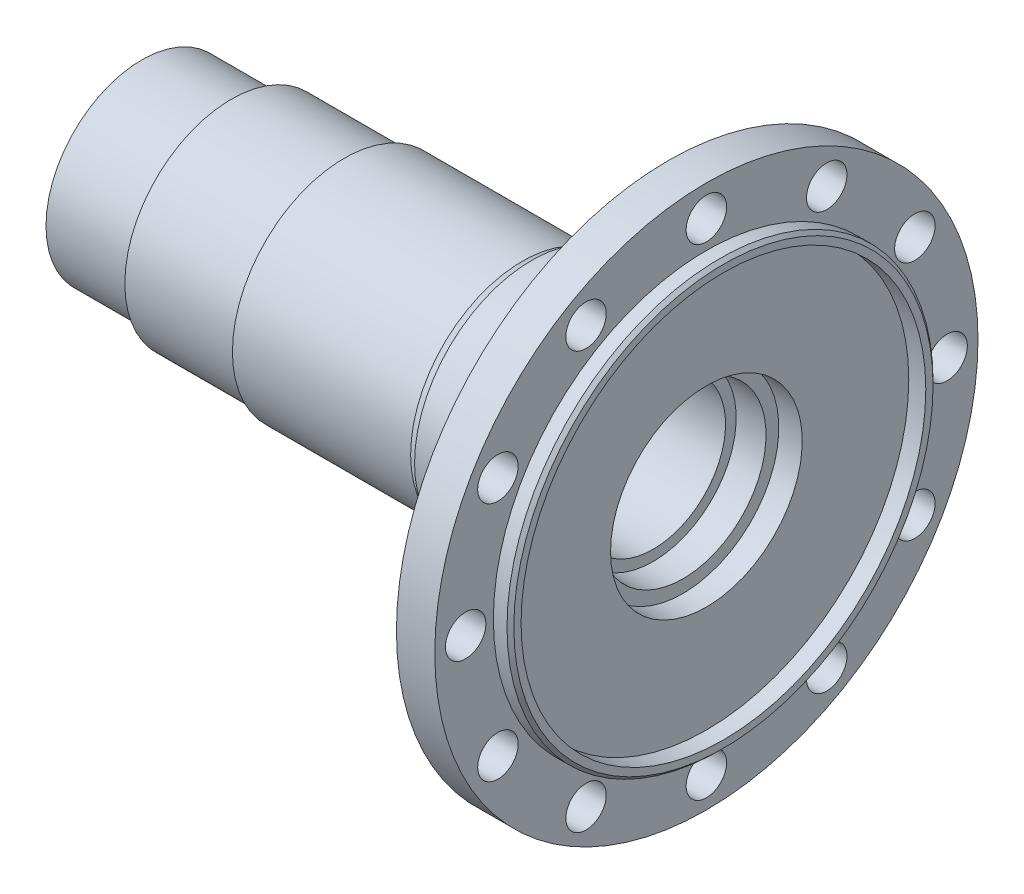
from build123d import *

# Parameters (mm, degrees)
SKETCH_3_R           = 9.5
CUT_EXTRUDE_1_DEPTH  = 328.171973127
SKETCH_4_R           = 9.5
CUT_EXTRUDE_2_DEPTH  = 328.171973127
SKETCH_5_R           = 9.5
CUT_EXTRUDE_3_DEPTH  = 328.171973127
SKETCH_6_R           = 9.5
CUT_EXTRUDE_4_DEPTH  = 328.171973127
SKETCH_7_R           = 9.5
CUT_EXTRUDE_5_DEPTH  = 328.171973127
SKETCH_8_R           = 9.5
CUT_EXTRUDE_6_DEPTH  = 328.171973127
SKETCH_9_R           = 9.5
CUT_EXTRUDE_7_DEPTH  = 328.171973127
SKETCH_10_R          = 9.5
CUT_EXTRUDE_8_DEPTH  = 328.171973127
SKETCH_11_R          = 9.5
CUT_EXTRUDE_9_DEPTH  = 328.171973127
SKETCH_12_R          = 9.5
CUT_EXTRUDE_10_DEPTH = 328.171973127
SKETCH_13_R          = 9.5
CUT_EXTRUDE_11_DEPTH = 328.171973127
SKETCH_14_R          = 9.5
CUT_EXTRUDE_12_DEPTH = 328.171973127


with BuildPart() as part:
    # Эскиз1 → Повернуть1 (revolve)
    with BuildSketch(Plane.XY, mode=Mode.PRIVATE) as revolve_1_sk:
        Polygon((0, 0), (273, 0), (273, 98.4), (271.4, 100), (265, 100), (265, 127.5), (247, 127.5), (247, 100), (239, 100), (239, 62.5), (215, 62.5), (215, 55), (183, 55), (178.669872981, 52.5), (95, 52.5), (95, 50), (42, 50), (42, 45), (0, 45), align=None)
    revolve(revolve_1_sk.sketch.rotate(Axis((0, 0, 0), (1, 0, 0)), 90), axis=Axis((0, 0, 0), (1, 0, 0)))

    # Эскиз2 → Вырез-Повернуть1 (revolve, cut)
    with BuildSketch(Plane.XY, mode=Mode.PRIVATE) as cut_revolve_1_sk:
        Polygon((0, 0), (273, 0), (273, 95), (265, 95), (265, 45), (254, 45), (254, 39), (240, 39), (240, 34), (203.5, 34), (203.5, 31), (0, 31), align=None)
    revolve(cut_revolve_1_sk.sketch.rotate(Axis((0, 0, 0), (1, 0, 0)), 90), axis=Axis((0, 0, 0), (1, 0, 0)), mode=Mode.SUBTRACT)

    # Эскиз3 → Вырез-Вытянуть1 (cut, through all)
    with BuildSketch(Plane(origin=(0, 0, 0), x_dir=(0, 0, -1), z_dir=(1, 0, 0))):
        with Locations(Location((0, 113, 0), (0, 0, 180))):
            Circle(SKETCH_3_R)
    extrude(amount=CUT_EXTRUDE_1_DEPTH, mode=Mode.SUBTRACT)

    # Эскиз4 → Вырез-Вытянуть2 (cut, through all)
    with BuildSketch(Plane(origin=(0, 0, 0), x_dir=(0, 0, -1), z_dir=(1, 0, 0))):
        with Locations(Location((-56.5, 97.860870628, 0), (0, 0, 180))):
            Circle(SKETCH_4_R)
    extrude(amount=CUT_EXTRUDE_2_DEPTH, mode=Mode.SUBTRACT)

    # Эскиз5 → Вырез-Вытянуть3 (cut, through all)
    with BuildSketch(Plane(origin=(0, 0, 0), x_dir=(0, 0, -1), z_dir=(1, 0, 0))):
        with Locations(Location((-97.860870628, 56.5, 0), (0, 0, 180))):
            Circle(SKETCH_5_R)
    extrude(amount=CUT_EXTRUDE_3_DEPTH, mode=Mode.SUBTRACT)

    # Эскиз6 → Вырез-Вытянуть4 (cut, through all)
    with BuildSketch(Plane(origin=(0, 0, 0), x_dir=(0, 0, -1), z_dir=(1, 0, 0))):
        with Locations(Location((-113, 0, 0), (0, 0, 180))):
            Circle(SKETCH_6_R)
    extrude(amount=CUT_EXTRUDE_4_DEPTH, mode=Mode.SUBTRACT)

    # Эскиз7 → Вырез-Вытянуть5 (cut, through all)
    with BuildSketch(Plane(origin=(0, 0, 0), x_dir=(0, 0, -1), z_dir=(1, 0, 0))):
        with Locations(Location((-97.860870628, -56.5, 0), (0, 0, 180))):
            Circle(SKETCH_7_R)
    extrude(amount=CUT_EXTRUDE_5_DEPTH, mode=Mode.SUBTRACT)

    # Эскиз8 → Вырез-Вытянуть6 (cut, through all)
    with BuildSketch(Plane(origin=(0, 0, 0), x_dir=(0, 0, -1), z_dir=(1, 0, 0))):
        with Locations(Location((-56.5, -97.860870628, 0), (0, 0, 180))):
            Circle(SKETCH_8_R)
    extrude(amount=CUT_EXTRUDE_6_DEPTH, mode=Mode.SUBTRACT)

    # Эскиз9 → Вырез-Вытянуть7 (cut, through all)
    with BuildSketch(Plane(origin=(0, 0, 0), x_dir=(0, 0, -1), z_dir=(1, 0, 0))):
        with Locations(Location((0, -113, 0), (0, 0, 180))):
            Circle(SKETCH_9_R)
    extrude(amount=CUT_EXTRUDE_7_DEPTH, mode=Mode.SUBTRACT)

    # Эскиз10 → Вырез-Вытянуть8 (cut, through all)
    with BuildSketch(Plane(origin=(0, 0, 0), x_dir=(0, 0, -1), z_dir=(1, 0, 0))):
        with Locations(Location((56.5, -97.860870628, 0), (0, 0, 180))):
            Circle(SKETCH_10_R)
    extrude(amount=CUT_EXTRUDE_8_DEPTH, mode=Mode.SUBTRACT)

    # Эскиз11 → Вырез-Вытянуть9 (cut, through all)
    with BuildSketch(Plane(origin=(0, 0, 0), x_dir=(0, 0, -1), z_dir=(1, 0, 0))):
        with Locations(Location((97.860870628, -56.5, 0), (0, 0, 180))):
            Circle(SKETCH_11_R)
    extrude(amount=CUT_EXTRUDE_9_DEPTH, mode=Mode.SUBTRACT)

    # Эскиз12 → Вырез-Вытянуть10 (cut, through all)
    with BuildSketch(Plane(origin=(0, 0, 0), x_dir=(0, 0, -1), z_dir=(1, 0, 0))):
        with Locations(Location((113, 0, 0), (0, 0, 180))):
            Circle(SKETCH_12_R)
    extrude(amount=CUT_EXTRUDE_10_DEPTH, mode=Mode.SUBTRACT)

    # Эскиз13 → Вырез-Вытянуть11 (cut, through all)
    with BuildSketch(Plane(origin=(0, 0, 0), x_dir=(0, 0, -1), z_dir=(1, 0, 0))):
        with Locations(Location((97.860870628, 56.5, 0), (0, 0, 180))):
            Circle(SKETCH_13_R)
    extrude(amount=CUT_EXTRUDE_11_DEPTH, mode=Mode.SUBTRACT)

    # Эскиз14 → Вырез-Вытянуть12 (cut, through all)
    with BuildSketch(Plane(origin=(0, 0, 0), x_dir=(0, 0, -1), z_dir=(1, 0, 0))):
        with Locations(Location((56.5, 97.860870628, 0), (0, 0, 180))):
            Circle(SKETCH_14_R)
    extrude(amount=CUT_EXTRUDE_12_DEPTH, mode=Mode.SUBTRACT)


solid = part.part
